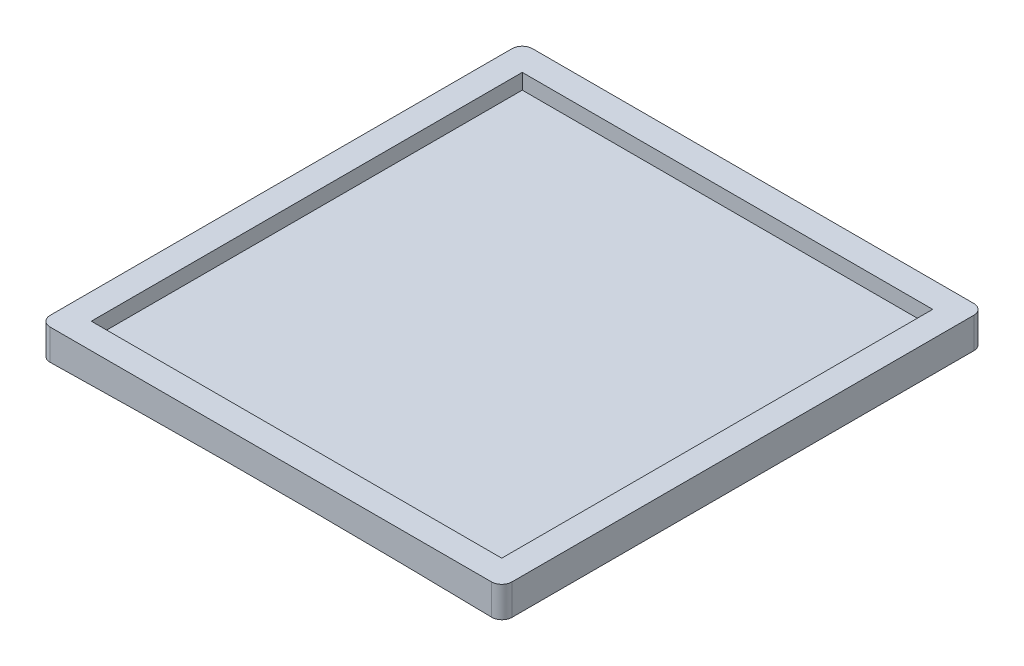
from build123d import *

# Parameters (mm, degrees)
BOSS_EXTRUDE1_DEPTH     = 3
CUT_EXTRUDE1_DEPTH      = 33.672618505
CUT_EXTRUDE1_DEPTH_BACK = 33.672618505
SKETCH4_W               = 40
SKETCH4_H               = 42
CUT_EXTRUDE2_DEPTH      = 1.5


with BuildPart() as part:
    # Sketch1 → Boss-Extrude1 (new body)
    with BuildSketch(Plane(origin=(0, 0, 0), x_dir=(1, 0, 0), z_dir=(0, 1, 0))):
        with BuildLine():
            Line((21.5, 23.5), (-21.5, 23.5))
            ThreePointArc((-21.5, 23.5), (-22.207106781, 23.207106781), (-22.5, 22.5))
            Line((-22.5, 22.5), (-22.5, -22.5))
            ThreePointArc((-22.5, -22.5), (-22.207106781, -23.207106781), (-21.5, -23.5))
            Line((-21.5, -23.5), (21.5, -23.5))
            ThreePointArc((21.5, -23.5), (22.207106781, -23.207106781), (22.5, -22.5))
            Line((22.5, -22.5), (22.5, 22.5))
            ThreePointArc((22.5, 22.5), (22.207106781, 23.207106781), (21.5, 23.5))
        make_face()
    extrude(amount=-BOSS_EXTRUDE1_DEPTH)

    # Sketch2 → Cut-Extrude1 (cut, two sides: drawn at the far end of the back side and taken through both)
    with BuildSketch(Plane.XY.offset(-CUT_EXTRUDE1_DEPTH_BACK)):
        with BuildLine():
            Line((-22.5, -3), (22.5, -3))
            ThreePointArc((22.5, -3), (0, -2.75), (-22.5, -3))
        make_face()
    extrude(amount=CUT_EXTRUDE1_DEPTH + CUT_EXTRUDE1_DEPTH_BACK, mode=Mode.SUBTRACT)

    # Sketch4 → Cut-Extrude2 (cut)
    with BuildSketch(Plane(origin=(0, 0, 0), x_dir=(1, 0, 0), z_dir=(0, 1, 0))):
        Rectangle(SKETCH4_W, SKETCH4_H)
    extrude(amount=-CUT_EXTRUDE2_DEPTH, mode=Mode.SUBTRACT)


solid = part.part
